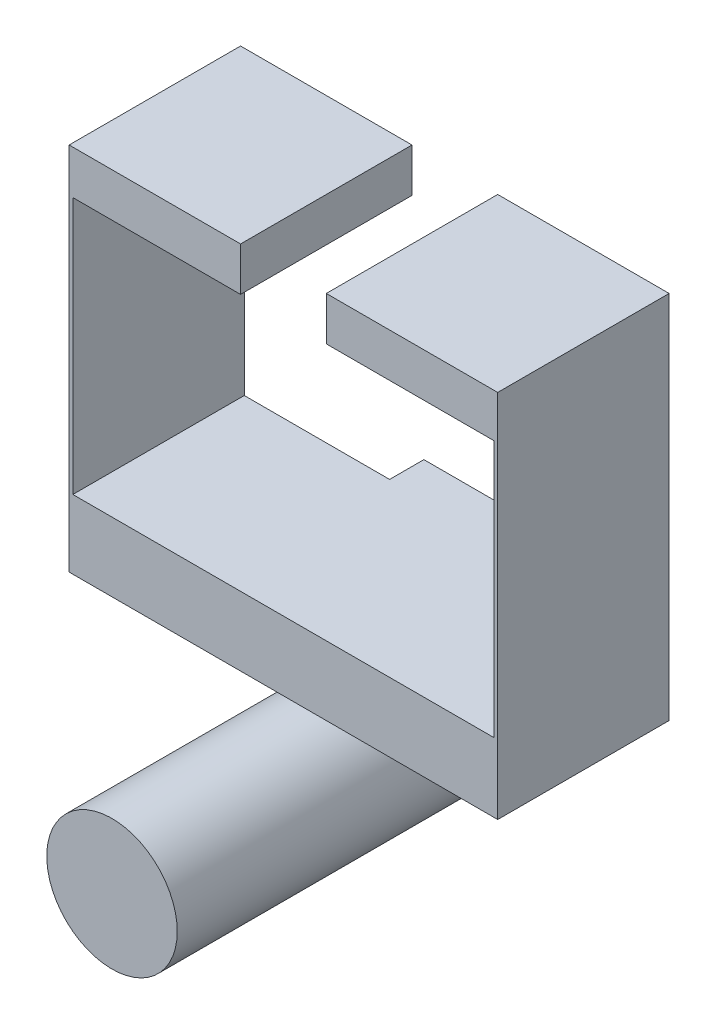
from build123d import *

# Parameters (mm, degrees)
SKETCH1_R           = 9.667215137
BOSS_EXTRUDE1_DEPTH = 50.8
SKETCH2_W           = 19.334430274
SKETCH2_H           = 12.7
BOSS_EXTRUDE2_DEPTH = 8.89
BOSS_EXTRUDE3_DEPTH = 25.4
SKETCH5_W           = 0.549916313
SKETCH5_H           = 38.1
BOSS_EXTRUDE4_DEPTH = 25.4
SKETCH6_W           = 25.4
SKETCH6_H           = 6.473300788
BOSS_EXTRUDE5_DEPTH = 25.4
BOSS_EXTRUDE6_DEPTH = 8.89
BOSS_EXTRUDE7_START = 5.08
BOSS_EXTRUDE7_DEPTH = 5.08


with BuildPart() as part:
    # Sketch1 → Boss-Extrude1 (new body)
    with BuildSketch(Plane.XY):
        Circle(SKETCH1_R)
    extrude(amount=BOSS_EXTRUDE1_DEPTH)

    # Sketch2 → Boss-Extrude2 (add)
    with BuildSketch(Plane(origin=(0, 0, 0), x_dir=(-1, 0, 0), z_dir=(0, 0, -1))):
        with Locations((0, 6.35)):
            Rectangle(SKETCH2_W, SKETCH2_H)
    extrude(amount=-BOSS_EXTRUDE2_DEPTH)

    # Sketch4 → Boss-Extrude3 (add)
    with BuildSketch(Plane(origin=(0, 0, 0), x_dir=(-1, 0, 0), z_dir=(0, 0, -1))):
        Polygon((-31.75, 12.7), (-31.75, 22.935187234), (31.75, 22.935187234), (31.75, 12.7), (9.667215137, 12.7), (-9.667215137, 12.7), align=None)
    extrude(amount=-BOSS_EXTRUDE3_DEPTH)

    # Sketch5 → Boss-Extrude4 (add)
    with BuildSketch(Plane(origin=(0, 0, 0), x_dir=(-1, 0, 0), z_dir=(0, 0, -1))):
        with Locations((31.475041844, 41.985187234)):
            Rectangle(SKETCH5_W, SKETCH5_H)
        with Locations((-31.475041844, 41.985187234)):
            Rectangle(SKETCH5_W, SKETCH5_H)
    extrude(amount=-BOSS_EXTRUDE4_DEPTH)

    # Sketch6 → Boss-Extrude5 (add)
    with BuildSketch(Plane(origin=(0, 0, 0), x_dir=(-1, 0, 0), z_dir=(0, 0, -1))):
        with Locations((19.05, 64.271837628)):
            Rectangle(SKETCH6_W, SKETCH6_H)
        with Locations((-19.05, 64.271837628)):
            Rectangle(SKETCH6_W, SKETCH6_H)
    extrude(amount=-BOSS_EXTRUDE5_DEPTH)

    # Sketch7 → Boss-Extrude6 (add)
    with BuildSketch(Plane(origin=(0, 0, 0), x_dir=(-1, 0, 0), z_dir=(0, 0, -1))):
        Polygon((-31.75, 12.7), (-9.667215137, 0), (-9.667215137, 2.54), (-29.21, 12.7), align=None)
        Polygon((9.667215137, 0), (31.75, 12.7), (29.21, 12.7), (9.667215137, 2.54), align=None)
    extrude(amount=-BOSS_EXTRUDE6_DEPTH)

    # Sketch14 → Boss-Extrude7 (add)
    with BuildSketch(Plane(origin=(0, 0, 0), x_dir=(-1, 0, 0), z_dir=(0, 0, -1)).offset(BOSS_EXTRUDE7_START)):
        with BuildLine():
            Line((9.667215137, 22.935187234), (-9.667215137, 22.935187234))
            Line((-9.667215137, 22.935187234), (-9.667215137, 0))
            ThreePointArc((-9.667215137, 0), (0, -9.667215137), (9.667215137, 0))
            Line((9.667215137, 0), (9.667215137, 22.935187234))
        make_face()
    extrude(amount=-BOSS_EXTRUDE7_DEPTH)


solid = part.part
